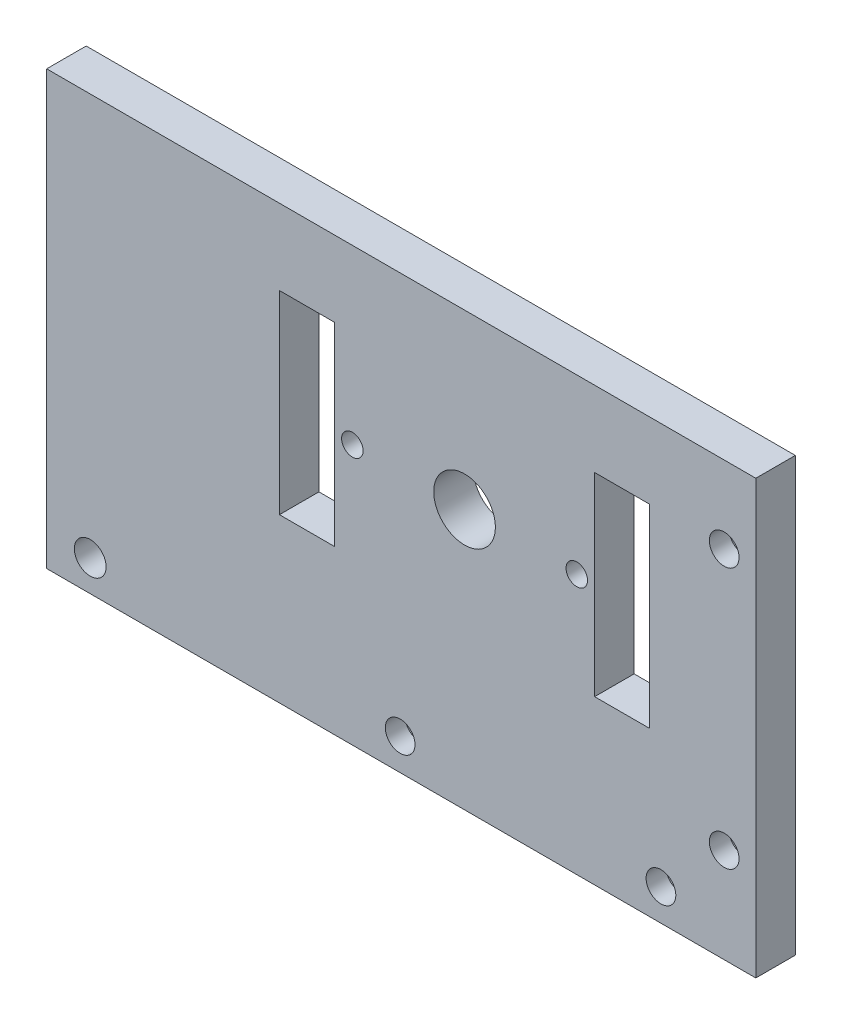
from build123d import *

# Parameters (mm, degrees)
SKETCH5_W               = 88.55
SKETCH5_H               = 69.55
SKETCH5_R               = 2.3876
SKETCH5_R_2             = 3.683
SKETCH5_R_3             = 4.953
SKETCH5_W_2             = 8.85
SKETCH5_H_2             = 31.2
SKETCH5_R_4             = 1.5875
BOSS_EXTRUDE1_DEPTH     = 6.35
F_8_32_TAPPED_HOLE1_D   = 3.4544
CUT_EXTRUDE2_START      = 3.175
SKETCH5_3_R             = 2.3876
SKETCH5_3_R_2           = 1.5875
CUT_EXTRUDE2_DEPTH      = 3.175
SKETCH8_W               = 25.4
SKETCH8_H               = 69.55
SKETCH8_R               = 1
BOSS_EXTRUDE2_DEPTH     = 6.35
F_1_4_20_TAPPED_HOLE2_D = 5.1054


with BuildPart() as part:
    # Sketch5 → Boss-Extrude1 (new body)
    # profile 1 of 6: a face of its own
    with BuildSketch(Plane.XY):
        with Locations((-47.069, 37.569)):
            Rectangle(SKETCH5_W, SKETCH5_H)
        with Locations((-7.874, 18.034)):
            Circle(SKETCH5_R, mode=Mode.SUBTRACT)
        with Locations((-7.874, 59.944)):
            Circle(SKETCH5_R, mode=Mode.SUBTRACT)
        with Locations((-18.034, 7.874)):
            Circle(SKETCH5_R, mode=Mode.SUBTRACT)
        with Locations((-59.944, 7.874)):
            Circle(SKETCH5_R, mode=Mode.SUBTRACT)
        with Locations((-19.9136, 19.9136)):
            Circle(SKETCH5_R_2, mode=Mode.SUBTRACT)
        with Locations((-49.594, 44.594)):
            Circle(SKETCH5_R_3, mode=Mode.SUBTRACT)
        with Locations((-74.919, 44.594)):
            Rectangle(SKETCH5_W_2, SKETCH5_H_2, mode=Mode.SUBTRACT)
        with Locations((-24.269, 44.594)):
            Rectangle(SKETCH5_W_2, SKETCH5_H_2, mode=Mode.SUBTRACT)
    # profile 2 of 6: a face of its own
    with BuildSketch(Plane.XY):
        with Locations((-7.874, 59.944)):
            Circle(SKETCH5_R)
        with Locations((-7.874, 59.944)):
            Circle(SKETCH5_R_4, mode=Mode.SUBTRACT)
    # profile 3 of 6: a face of its own
    with BuildSketch(Plane.XY):
        with Locations((-19.9136, 19.9136)):
            Circle(SKETCH5_R_2)
    # profile 4 of 6: a face of its own
    with BuildSketch(Plane.XY):
        with Locations((-7.874, 18.034)):
            Circle(SKETCH5_R)
        with Locations((-7.874, 18.034)):
            Circle(SKETCH5_R_4, mode=Mode.SUBTRACT)
    # profile 5 of 6: a face of its own
    with BuildSketch(Plane.XY):
        with Locations((-18.034, 7.874)):
            Circle(SKETCH5_R)
        with Locations((-18.034, 7.874)):
            Circle(SKETCH5_R_4, mode=Mode.SUBTRACT)
    # profile 6 of 6: a face of its own
    with BuildSketch(Plane.XY):
        with Locations((-59.944, 7.874)):
            Circle(SKETCH5_R)
        with Locations((-59.944, 7.874)):
            Circle(SKETCH5_R_4, mode=Mode.SUBTRACT)
    extrude(amount=BOSS_EXTRUDE1_DEPTH)

    # #8-32 Tapped Hole1 (through all)
    with Locations(Plane(origin=(-67.628, 44.594, 6.35), x_dir=(1, 0, 0), z_dir=(0, 0, 1))):
        with Locations((0, 0), (36.068, 0)):
            Hole(F_8_32_TAPPED_HOLE1_D / 2)

    # Sketch5<3> → Cut-Extrude2 (cut)
    # profile 1 of 4: a face of its own
    with BuildSketch(Plane.XY.offset(CUT_EXTRUDE2_START)):
        with Locations((-18.034, 7.874)):
            Circle(SKETCH5_3_R)
        with Locations((-18.034, 7.874)):
            Circle(SKETCH5_3_R_2, mode=Mode.SUBTRACT)
    # profile 2 of 4: a face of its own
    with BuildSketch(Plane.XY.offset(CUT_EXTRUDE2_START)):
        with Locations((-7.874, 18.034)):
            Circle(SKETCH5_3_R)
        with Locations((-7.874, 18.034)):
            Circle(SKETCH5_3_R_2, mode=Mode.SUBTRACT)
    # profile 3 of 4: a face of its own
    with BuildSketch(Plane.XY.offset(CUT_EXTRUDE2_START)):
        with Locations((-59.944, 7.874)):
            Circle(SKETCH5_3_R)
        with Locations((-59.944, 7.874)):
            Circle(SKETCH5_3_R_2, mode=Mode.SUBTRACT)
    # profile 4 of 4: a face of its own
    with BuildSketch(Plane.XY.offset(CUT_EXTRUDE2_START)):
        with Locations((-7.874, 59.944)):
            Circle(SKETCH5_3_R)
        with Locations((-7.874, 59.944)):
            Circle(SKETCH5_3_R_2, mode=Mode.SUBTRACT)
    extrude(amount=CUT_EXTRUDE2_DEPTH, mode=Mode.SUBTRACT)

    # Sketch8 → Boss-Extrude2 (add)
    with BuildSketch(Plane.XY):
        with Locations((-104.044, 37.569)):
            Rectangle(SKETCH8_W, SKETCH8_H)
        with Locations((-109.744, 7.794)):
            Circle(SKETCH8_R, mode=Mode.SUBTRACT)
    extrude(amount=BOSS_EXTRUDE2_DEPTH)

    # 1/4-20 Tapped Hole2 (through all)
    with Locations(Plane(origin=(-109.744, 7.794, 6.35), x_dir=(1, 0, 0), z_dir=(0, 0, 1))):
        with Locations((0, 0)):
            Hole(F_1_4_20_TAPPED_HOLE2_D / 2)


solid = part.part
